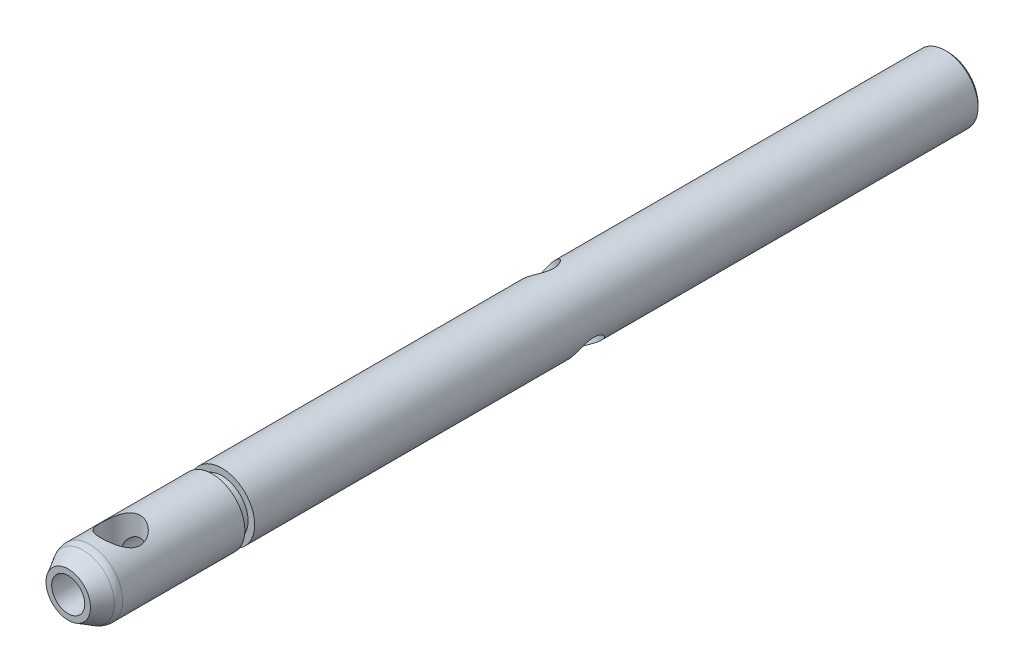
from build123d import *

# Parameters (mm, degrees)
CUT_EXTRUDE1_START           = -4
CUT_EXTRUDE1_DEPTH           = 4
F_3_0_3_DIAMETER_HOLE1_D     = 3
M2_CLEARANCE_HOLE1_REACH     = 69.343
M2_CLEARANCE_HOLE1_BORE_R    = 1.2645
F_2_0_2_DIAMETER_HOLE1_D     = 2
F_2_0_2_DIAMETER_HOLE1_DEPTH = 1.631966011
M2_CLEARANCE_HOLE2_D         = 2.529
M2_CLEARANCE_HOLE2_DEPTH     = 5.5
M2_CLEARANCE_HOLE3_D         = 2.529
M2_CLEARANCE_HOLE3_DEPTH     = 6.035533906
CHAMFER1_SIZE                = 0.2
FILLET1_R                    = 1


with BuildPart() as part:
    # Sketch1 → Revolve1 (revolve)
    with BuildSketch(Plane.XZ, mode=Mode.PRIVATE) as revolve1_sk:
        Polygon((1.7, 11.75), (0, 11.75), (0, -55.5), (2.5, -55.5), (2.5, 0), (2, 0), (2, 0.75), (2.5, 0.75), (2.5, 10.364359354), align=None)
    revolve(revolve1_sk.sketch.rotate(Axis((0, 0, 11.75), (0, 0, -1)), 180), axis=Axis((0, 0, 11.75), (0, 0, -1)))

    # Sketch2 → Cut-Extrude1 (cut)
    with BuildSketch(Plane(origin=(0, 0, -52.5), x_dir=(-1, 0, 0), z_dir=(0, 0, -1)).offset(CUT_EXTRUDE1_START)):
        with BuildLine():
            Line((1.5, -2), (-1.5, -2))
            ThreePointArc((-1.5, -2), (0, -2.5), (1.5, -2))
        make_face()
    extrude(amount=CUT_EXTRUDE1_DEPTH, mode=Mode.SUBTRACT)

    # Ø3.0 (3) Diameter Hole1 (through all)
    with Locations(Plane(origin=(0, -2.5, 7.75), x_dir=(-1, 0, 0), z_dir=(0, -1, 0))):
        with Locations((0, 0)):
            Hole(F_3_0_3_DIAMETER_HOLE1_D / 2)

    # M2 Clearance Hole1 bore → M2 Clearance Hole1 (cut, up to next)
    with BuildSketch(Plane.XY.offset(11.75), mode=Mode.PRIVATE) as m2_clearance_hole1_sk1:
        Circle(M2_CLEARANCE_HOLE1_BORE_R)
    m2_clearance_hole1_tool1 = extrude(m2_clearance_hole1_sk1.sketch, amount=-M2_CLEARANCE_HOLE1_REACH, mode=Mode.PRIVATE) & part.part
    add(m2_clearance_hole1_tool1.solids().sort_by_distance((0, 0, 11.75))[0], mode=Mode.SUBTRACT)

    # Ø2.0 (2) Diameter Hole1
    with Locations(Plane.XY.offset(6.631966011)):
        with Locations((0, 0)):
            Hole(F_2_0_2_DIAMETER_HOLE1_D / 2, depth=F_2_0_2_DIAMETER_HOLE1_DEPTH)

    # M2 Clearance Hole2
    with Locations(Plane(origin=(0, 0, -55.5), x_dir=(-1, 0, 0), z_dir=(0, 0, -1))):
        with Locations((0, 0)):
            Hole(M2_CLEARANCE_HOLE2_D / 2, depth=M2_CLEARANCE_HOLE2_DEPTH)

    # M2 Clearance Hole3
    with Locations(Plane(origin=(1.767766953, -1.767766953, -26), x_dir=(0.707106781187, 0.707106781187, 0), z_dir=(0.707106781187, -0.707106781187, 0))):
        with Locations((0, 0)):
            Hole(M2_CLEARANCE_HOLE3_D / 2, depth=M2_CLEARANCE_HOLE3_DEPTH)

    # Chamfer1
    chamfer1_edges = [part.edges().sort_by_distance(p)[0] for p in [
        (2.5, 0, -55.5),
    ]]
    chamfer(chamfer1_edges, length=CHAMFER1_SIZE)

    # Fillet1
    fillet1_edges = [part.edges().sort_by_distance(p)[0] for p in [
        (2.5, 0, 10.364359354),
    ]]
    fillet(fillet1_edges, radius=FILLET1_R)


solid = part.part
